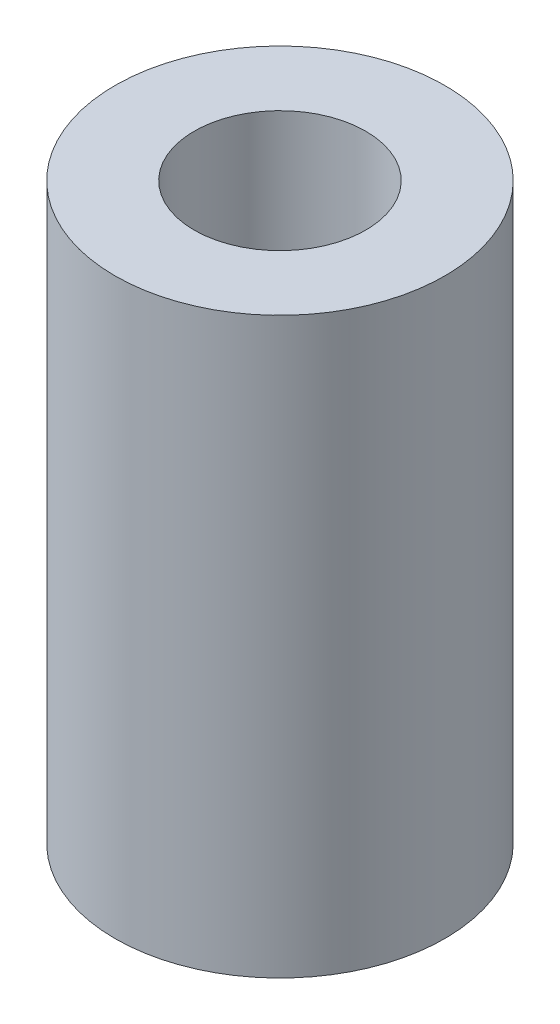
from build123d import *

# Parameters (mm, degrees)
SKETCH1_R           = 3.175
SKETCH1_R_2         = 1.651
BOSS_EXTRUDE1_DEPTH = 11.049


with BuildPart() as part:
    # Sketch1 → Boss-Extrude1 (new body)
    with BuildSketch(Plane(origin=(0, 0, 0), x_dir=(1, 0, 0), z_dir=(0, 1, 0))):
        with Locations(Location((0, 0, 0), (0, 0, 270))):
            Circle(SKETCH1_R)
        with Locations(Location((0, 0, 0), (0, 0, 270))):
            Circle(SKETCH1_R_2, mode=Mode.SUBTRACT)
    extrude(amount=BOSS_EXTRUDE1_DEPTH)


solid = part.part
